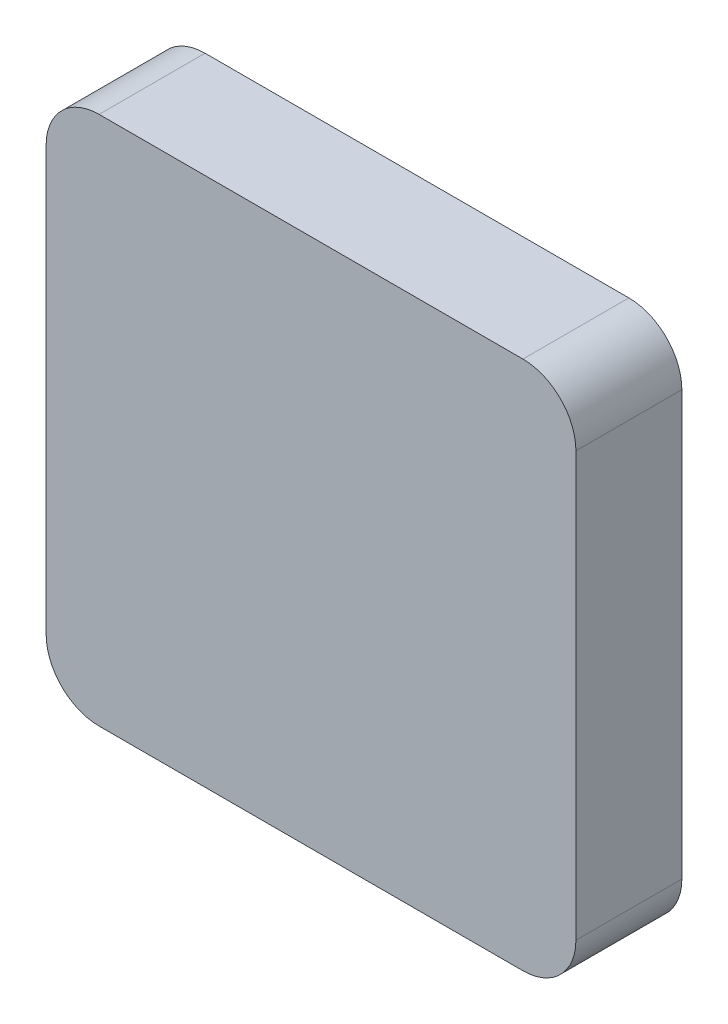
from build123d import *

# Parameters (mm, degrees)
SKETCH1_W           = 50
SKETCH1_H           = 50
BOSS_EXTRUDE1_DEPTH = 10
FILLET1_R           = 5


with BuildPart() as part:
    # Sketch1 → Boss-Extrude1 (new body)
    with BuildSketch(Plane.XY):
        Rectangle(SKETCH1_W, SKETCH1_H)
    extrude(amount=BOSS_EXTRUDE1_DEPTH)

    # Fillet1
    fillet1_edges = [part.edges().sort_by_distance(p)[0] for p in [
        (25, -25, 5),
        (-25, -25, 5),
        (-25, 25, 5),
        (25, 25, 5),
    ]]
    fillet(fillet1_edges, radius=FILLET1_R)


solid = part.part
